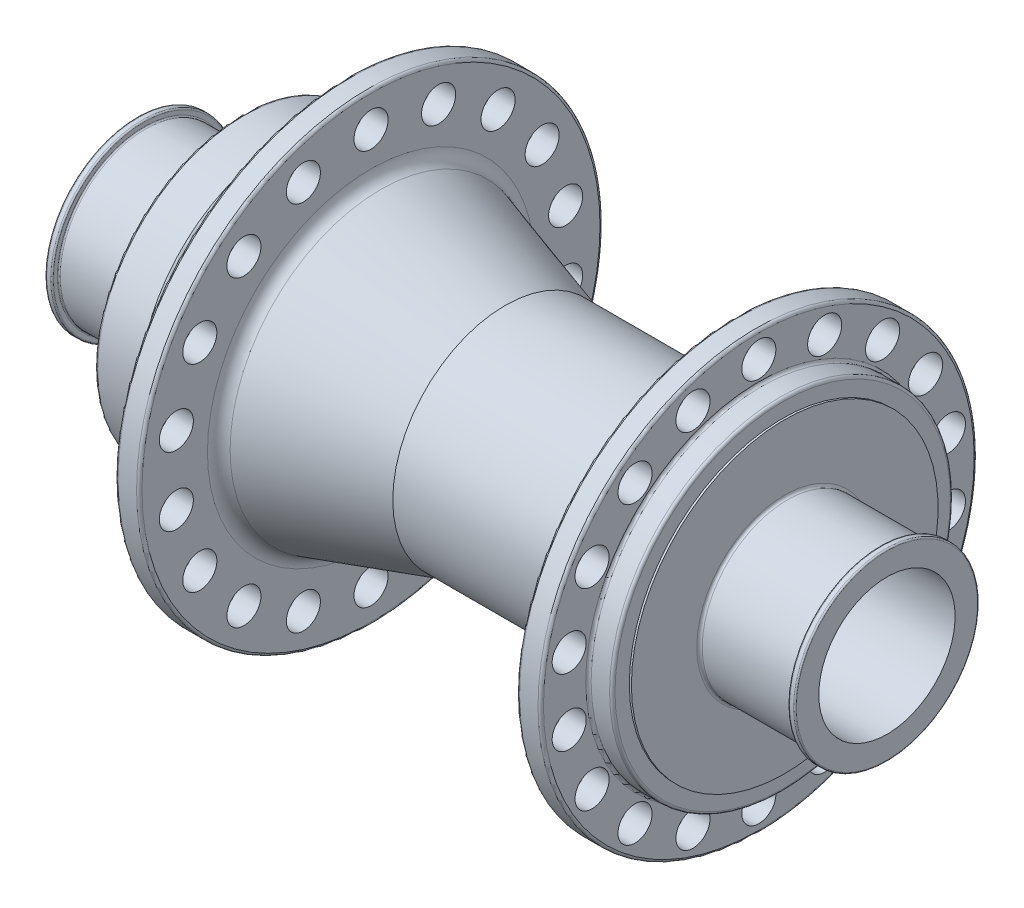
from build123d import *

# Parameters (mm, degrees)
WYTNIJ_WYCI_GNI_CIE1_REACH = 98.771
SZKIC5_R                   = 2.5
SZYK_KO_OWY1_COUNT         = 18
WYTNIJ_WYCI_GNI_CIE2_REACH = 108.815
SZKIC6_R                   = 2.5
SZYK_KO_OWY2_COUNT         = 18
WYTNIJ_WYCI_GNI_CIE3_REACH = 111.818
SZKIC7_R                   = 1.5
SZYK_KO_OWY3_COUNT         = 6


with BuildPart() as part:
    # Szkic1 → Obrót1 (revolve)
    with BuildSketch(Plane.XY, mode=Mode.PRIVATE) as obr_t1_sk:
        with BuildLine():
            Line((0, 0), (110, 0))
            Line((110, 0), (110, 3.3))
            ThreePointArc((110, 3.3), (109.941421356, 3.441421356), (109.8, 3.5))
            Line((109.8, 3.5), (109.2, 3.5))
            ThreePointArc((109.2, 3.5), (109.058578644, 3.441421356), (109, 3.3))
            Line((109, 3.3), (109, 2.7))
            ThreePointArc((109, 2.7), (108.941421356, 2.558578644), (108.8, 2.5))
            Line((108.8, 2.5), (95.4, 2.5))
            ThreePointArc((95.4, 2.5), (95.117157288, 2.617157288), (95, 2.9))
            Line((95, 2.9), (95, 12.5))
            Line((95, 12.5), (94.7, 12.5))
            Line((94.7, 12.5), (94.7, 14.6))
            ThreePointArc((94.7, 14.6), (94.582842712, 14.882842712), (94.3, 15))
            Line((94.3, 15), (91.6, 15))
            ThreePointArc((91.6, 15), (91.317157288, 15.117157288), (91.2, 15.4))
            Line((91.2, 15.4), (91.2, 21.6))
            ThreePointArc((91.2, 21.6), (91.082842712, 21.882842712), (90.8, 22))
            Line((90.8, 22), (88.1, 22))
            ThreePointArc((88.1, 22), (87.817157288, 21.882842712), (87.7, 21.6))
            Line((87.7, 21.6), (87.7, 10.501339824))
            ThreePointArc((87.7, 10.501339824), (87.286706681, 9.283816966), (86.21763809, 8.569488172))
            Line((86.21763809, 8.569488172), (78.494203088, 6.5))
            Line((78.494203088, 6.5), (53.990787399, 6.5))
            Line((53.990787399, 6.5), (35.715256591, 12.087390488))
            ThreePointArc((35.715256591, 12.087390488), (34.692286279, 12.810354426), (34.3, 14))
            Line((34.3, 14), (34.3, 23.6))
            ThreePointArc((34.3, 23.6), (34.182842712, 23.882842712), (33.9, 24))
            Line((33.9, 24), (31.2, 24))
            ThreePointArc((31.2, 24), (30.917157288, 23.882842712), (30.8, 23.6))
            Line((30.8, 23.6), (30.8, 5.35113841))
            ThreePointArc((30.8, 5.35113841), (30.682842712, 5.068295698), (30.4, 4.95113841))
            Line((30.4, 4.95113841), (24.106930795, 4.95113841))
            ThreePointArc((24.106930795, 4.95113841), (23.863426224, 5.033797074), (23.720560465, 5.247610792))
            Line((23.720560465, 5.247610792), (22.124677361, 11.203527618))
            ThreePointArc((22.124677361, 11.203527618), (21.981811602, 11.417341336), (21.73830703, 11.5))
            Line((21.73830703, 11.5), (15.7, 11.5))
            ThreePointArc((15.7, 11.5), (15.417157288, 11.382842712), (15.3, 11.1))
            Line((15.3, 11.1), (15.3, 6.45))
            Line((15.3, 6.45), (15.2, 6.45))
            ThreePointArc((15.2, 6.45), (15.058578644, 6.391421356), (15, 6.25))
            Line((15, 6.25), (15, 2.9))
            ThreePointArc((15, 2.9), (14.882842712, 2.617157288), (14.6, 2.5))
            Line((14.6, 2.5), (1.2, 2.5))
            ThreePointArc((1.2, 2.5), (1.058578644, 2.558578644), (1, 2.7))
            Line((1, 2.7), (1, 3.3))
            ThreePointArc((1, 3.3), (0.941421356, 3.441421356), (0.8, 3.5))
            Line((0.8, 3.5), (0.2, 3.5))
            ThreePointArc((0.2, 3.5), (0.058578644, 3.441421356), (0, 3.3))
            Line((0, 3.3), (0, 0))
        make_face()
    revolve(obr_t1_sk.sketch.rotate(Axis((0, -10, 0), (1, 0, 0)), 90), axis=Axis((0, -10, 0), (1, 0, 0)))

    # Szkic5 → Wytnij-wyciągnięcie1 (cut, up to next)
    with BuildSketch(Plane.ZY.offset(-30.8), mode=Mode.PRIVATE) as wytnij_wyci_gni_cie1_sk1:
        with Locations((0, 19)):
            Circle(SZKIC5_R)
    wytnij_wyci_gni_cie1_tool1 = extrude(wytnij_wyci_gni_cie1_sk1.sketch, amount=-WYTNIJ_WYCI_GNI_CIE1_REACH, mode=Mode.PRIVATE) & part.part
    wytnij_wyci_gni_cie1 = wytnij_wyci_gni_cie1_tool1.solids().sort_by_distance((30.8, 19, 0))[0]
    add(wytnij_wyci_gni_cie1, mode=Mode.SUBTRACT)

    # Szyk kołowy1: Wytnij-wyciągnięcie1 ×18 about axis
    szyk_ko_owy1_axis = Axis((0, -10, 0), (1, 0, 0))
    for i in range(1, SZYK_KO_OWY1_COUNT):
        add(wytnij_wyci_gni_cie1.rotate(szyk_ko_owy1_axis, i * 360 / SZYK_KO_OWY1_COUNT), mode=Mode.SUBTRACT)

    # Szkic6 → Wytnij-wyciągnięcie2 (cut, up to next)
    with BuildSketch(Plane(origin=(91.2, 0, 0), x_dir=(0, 0, -1), z_dir=(1, 0, 0)), mode=Mode.PRIVATE) as wytnij_wyci_gni_cie2_sk1:
        with Locations((0, 18.25)):
            Circle(SZKIC6_R)
    wytnij_wyci_gni_cie2_tool1 = extrude(wytnij_wyci_gni_cie2_sk1.sketch, amount=-WYTNIJ_WYCI_GNI_CIE2_REACH, mode=Mode.PRIVATE) & part.part
    wytnij_wyci_gni_cie2 = wytnij_wyci_gni_cie2_tool1.solids().sort_by_distance((91.2, 18.25, 0))[0]
    add(wytnij_wyci_gni_cie2, mode=Mode.SUBTRACT)

    # Szyk kołowy2: Wytnij-wyciągnięcie2 ×18 about axis
    szyk_ko_owy2_axis = Axis((0, -10, 0), (1, 0, 0))
    for i in range(1, SZYK_KO_OWY2_COUNT):
        add(wytnij_wyci_gni_cie2.rotate(szyk_ko_owy2_axis, i * 360 / SZYK_KO_OWY2_COUNT), mode=Mode.SUBTRACT)

    # Wytnij-wyciągnięcie3: up to this cone (the profile starts inside it)
    wytnij_wyci_gni_cie3_end = Plane(origin=(15.3, -10, 0), z_dir=(-1, 0, 0)).offset(-12.506144463) * Cone(3.732e-06, 640.038188513, 171.497714737, align=(Align.CENTER, Align.CENTER, Align.MIN), mode=Mode.PRIVATE)
    # Szkic7 → Wytnij-wyciągnięcie3 (cut, up to the surface)
    with BuildSketch(Plane.ZY.offset(-15.3), mode=Mode.PRIVATE) as wytnij_wyci_gni_cie3_sk1:
        with Locations((0, 8.75)):
            Circle(SZKIC7_R)
    wytnij_wyci_gni_cie3_tool1 = extrude(wytnij_wyci_gni_cie3_sk1.sketch, amount=-WYTNIJ_WYCI_GNI_CIE3_REACH, mode=Mode.PRIVATE) & wytnij_wyci_gni_cie3_end
    wytnij_wyci_gni_cie3 = wytnij_wyci_gni_cie3_tool1.solids().sort_by_distance((15.3, 8.75, 0))[0]
    add(wytnij_wyci_gni_cie3, mode=Mode.SUBTRACT)

    # Szyk kołowy3: Wytnij-wyciągnięcie3 ×6 about axis
    szyk_ko_owy3_axis = Axis((0, -10, 0), (1, 0, 0))
    for i in range(1, SZYK_KO_OWY3_COUNT):
        add(wytnij_wyci_gni_cie3.rotate(szyk_ko_owy3_axis, i * 360 / SZYK_KO_OWY3_COUNT), mode=Mode.SUBTRACT)


solid = part.part
